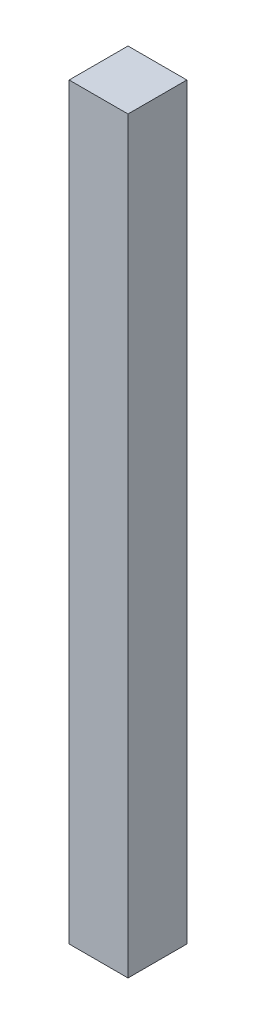
from build123d import *

# Parameters (mm, degrees)
SKETCH1_W           = 20
SKETCH1_H           = 20
BOSS_EXTRUDE1_DEPTH = 254.239201108


with BuildPart() as part:
    # Sketch1 → Boss-Extrude1 (new body)
    with BuildSketch(Plane(origin=(0, 0, 0), x_dir=(1, 0, 0), z_dir=(0, 1, 0))):
        with Locations((10, -10)):
            Rectangle(SKETCH1_W, SKETCH1_H)
    extrude(amount=BOSS_EXTRUDE1_DEPTH)


solid = part.part
